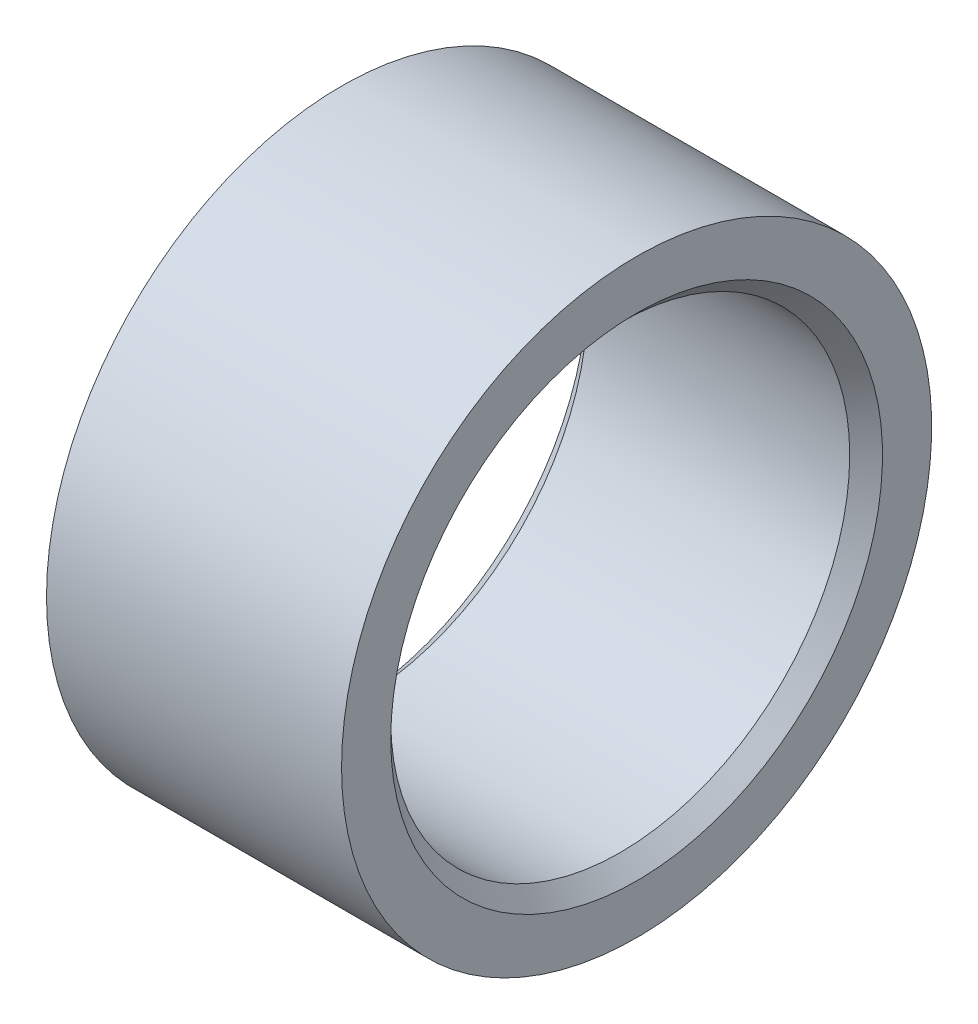
from build123d import *

# Parameters (mm, degrees)
ESQUISSE1_W     = 9
ESQUISSE1_H     = 2
CHANFREIN1_SIZE = 0.5


with BuildPart() as part:
    # Esquisse1 → Révolution1 (revolve)
    with BuildSketch(Plane.XY, mode=Mode.PRIVATE) as r_volution1_sk:
        with Locations((-4.5, 8)):
            Rectangle(ESQUISSE1_W, ESQUISSE1_H)
    revolve(r_volution1_sk.sketch.rotate(Axis((-22.812190984, 0, 0), (1, 0, 0)), 90), axis=Axis((-22.812190984, 0, 0), (1, 0, 0)))

    # Chanfrein1
    chanfrein1_edges = [part.edges().sort_by_distance(p)[0] for p in [
        (0, 0, -7),
        (-9, 0, -7),
    ]]
    chamfer(chanfrein1_edges, length=CHANFREIN1_SIZE)


solid = part.part
